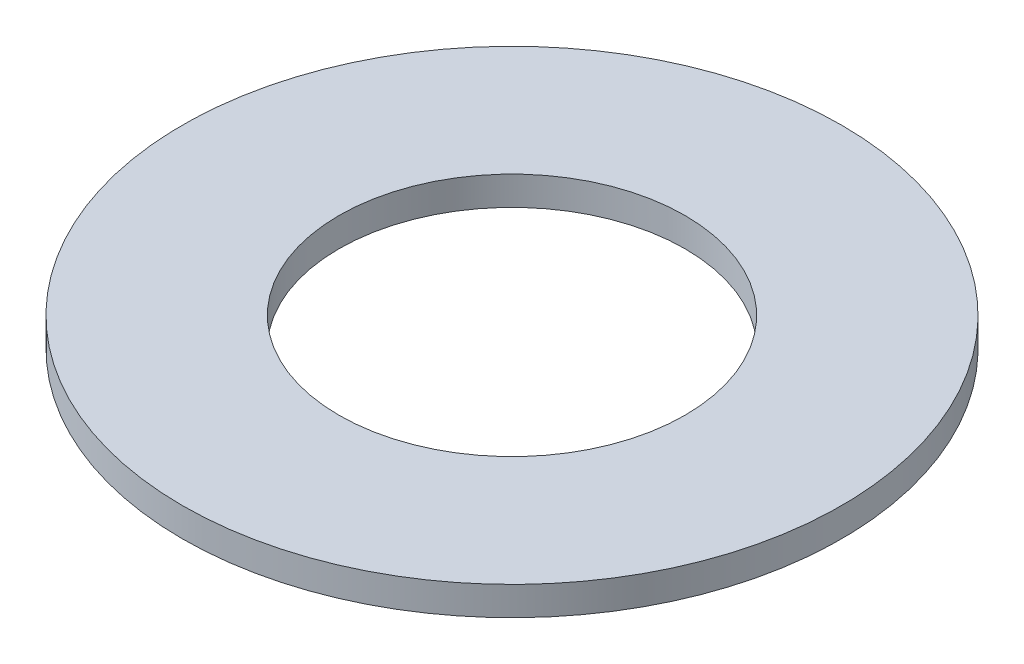
from build123d import *

# Parameters (mm, degrees)
ESQUISSE1_R        = 8
ESQUISSE1_R_2      = 4.2
BOSS_EXTRU_1_DEPTH = 0.7


with BuildPart() as part:
    # Esquisse1 → Boss.-Extru.1 (new body)
    with BuildSketch(Plane(origin=(0, 0, 0), x_dir=(1, 0, 0), z_dir=(0, 1, 0))):
        with Locations(Location((0, 0, 0), (0, 0, 270))):
            Circle(ESQUISSE1_R)
        with Locations(Location((0, 0, 0), (0, 0, 270))):
            Circle(ESQUISSE1_R_2, mode=Mode.SUBTRACT)
    extrude(amount=BOSS_EXTRU_1_DEPTH)


solid = part.part
